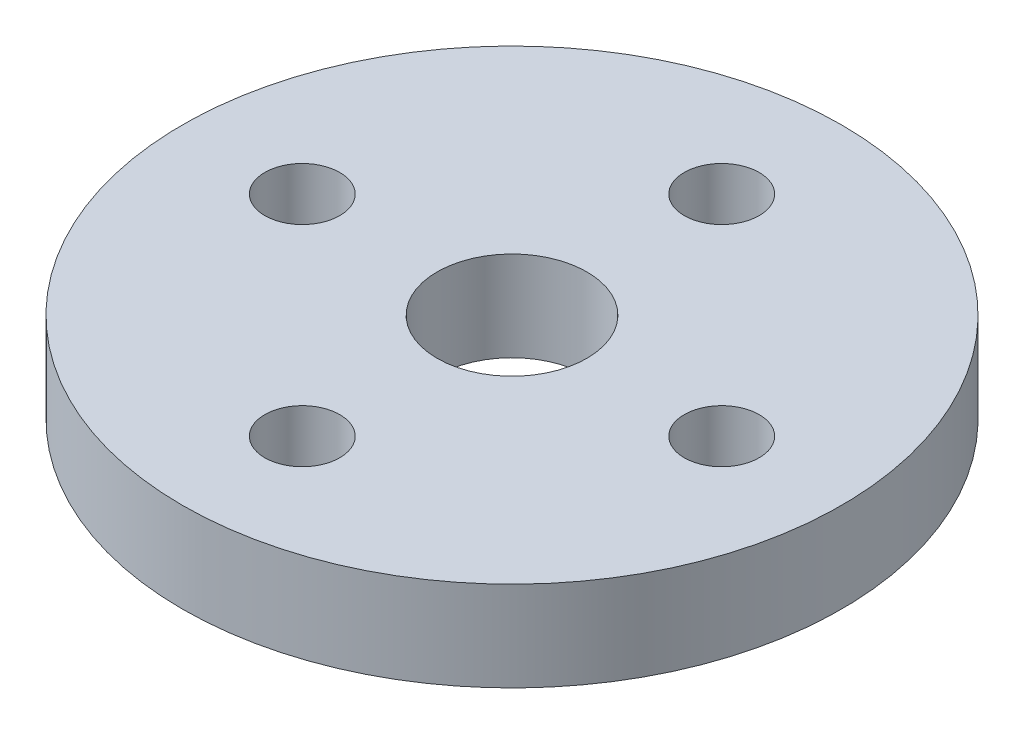
from build123d import *

# Parameters (mm, degrees)
SKETCH1_R           = 11
SKETCH1_R_2         = 2.5
SKETCH1_R_3         = 1.25
BOSS_EXTRUDE1_DEPTH = 3


with BuildPart() as part:
    # Sketch1 → Boss-Extrude1 (new body)
    with BuildSketch(Plane(origin=(0, 0, 0), x_dir=(1, 0, 0), z_dir=(0, 1, 0))):
        with Locations(Location((0, 0, 0), (0, 0, 270))):
            Circle(SKETCH1_R)
        with Locations(Location((0, 0, 0), (0, 0, 270))):
            Circle(SKETCH1_R_2, mode=Mode.SUBTRACT)
        with Locations(Location((0, 7, 0), (0, 0, 270))):
            Circle(SKETCH1_R_3, mode=Mode.SUBTRACT)
        with Locations(Location((7, 0, 0), (0, 0, 270))):
            Circle(SKETCH1_R_3, mode=Mode.SUBTRACT)
        with Locations(Location((0, -7, 0), (0, 0, 270))):
            Circle(SKETCH1_R_3, mode=Mode.SUBTRACT)
        with Locations(Location((-7, 0, 0), (0, 0, 270))):
            Circle(SKETCH1_R_3, mode=Mode.SUBTRACT)
    extrude(amount=BOSS_EXTRUDE1_DEPTH)


solid = part.part
